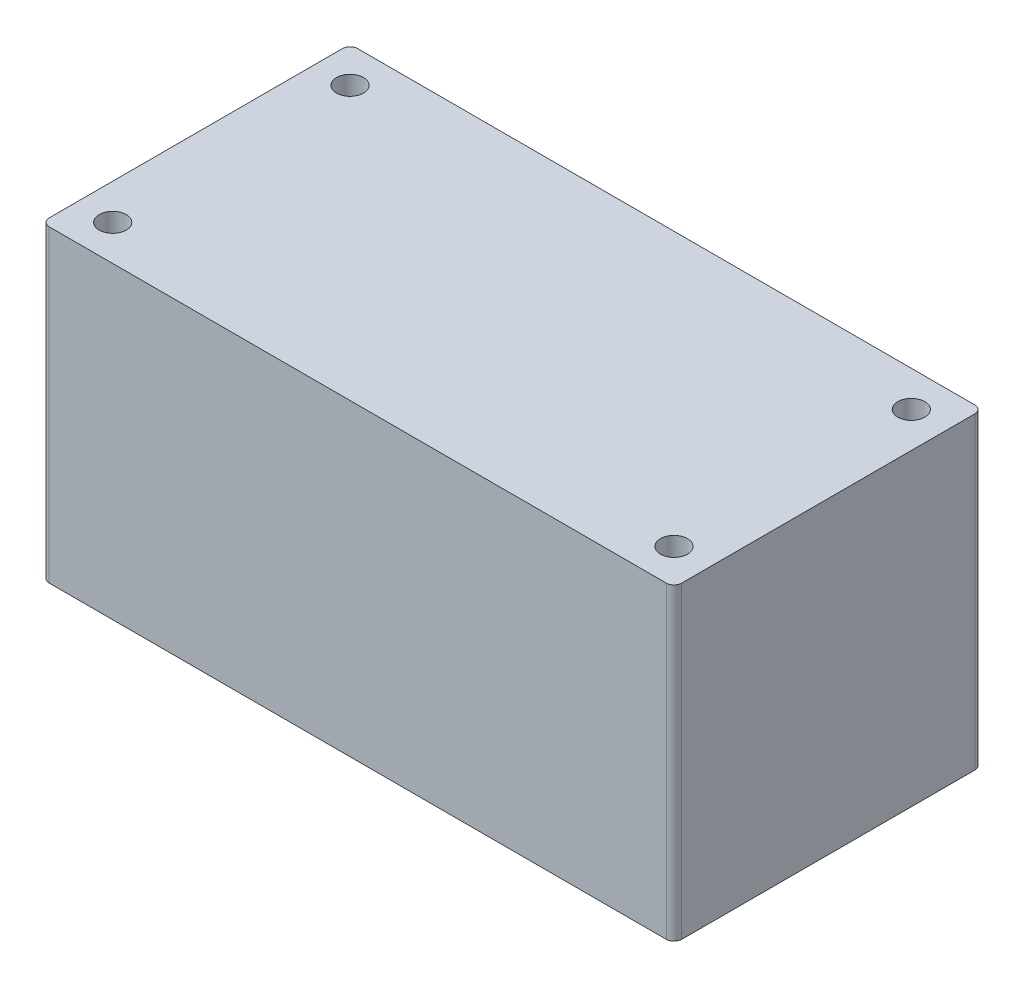
from build123d import *

# Parameters (mm, degrees)
SKETCH2_W           = 41
SKETCH2_H           = 20
BOSS_EXTRUDE1_DEPTH = 20
FILLET1_R           = 0.5
SKETCH3_R           = 0.875
CUT_EXTRUDE1_DEPTH  = 31.335622624


with BuildPart() as part:
    # Sketch2 → Boss-Extrude1 (new body)
    with BuildSketch(Plane(origin=(0, 0, 0), x_dir=(1, 0, 0), z_dir=(0, 1, 0))):
        Rectangle(SKETCH2_W, SKETCH2_H)
    extrude(amount=BOSS_EXTRUDE1_DEPTH)

    # Fillet1
    fillet1_edges = [part.edges().sort_by_distance(p)[0] for p in [
        (20.5, 10, 10),
        (-20.5, 10, 10),
        (-20.5, 10, -10),
        (20.5, 10, -10),
    ]]
    fillet(fillet1_edges, radius=FILLET1_R)

    # Sketch3 → Cut-Extrude1 (cut, through all)
    with BuildSketch(Plane(origin=(0, 20, 0), x_dir=(1, 0, 0), z_dir=(0, 1, 0))):
        with Locations(Location((18.190909091, 7.690909091, 0), (0, 0, 270))):
            Circle(SKETCH3_R)
        with Locations(Location((18.190909091, -7.690909091, 0), (0, 0, 270))):
            Circle(SKETCH3_R)
        with Locations(Location((-18.190909091, 7.690909091, 0), (0, 0, 270))):
            Circle(SKETCH3_R)
        with Locations(Location((-18.190909091, -7.690909091, 0), (0, 0, 270))):
            Circle(SKETCH3_R)
    extrude(amount=-CUT_EXTRUDE1_DEPTH, mode=Mode.SUBTRACT)


solid = part.part
